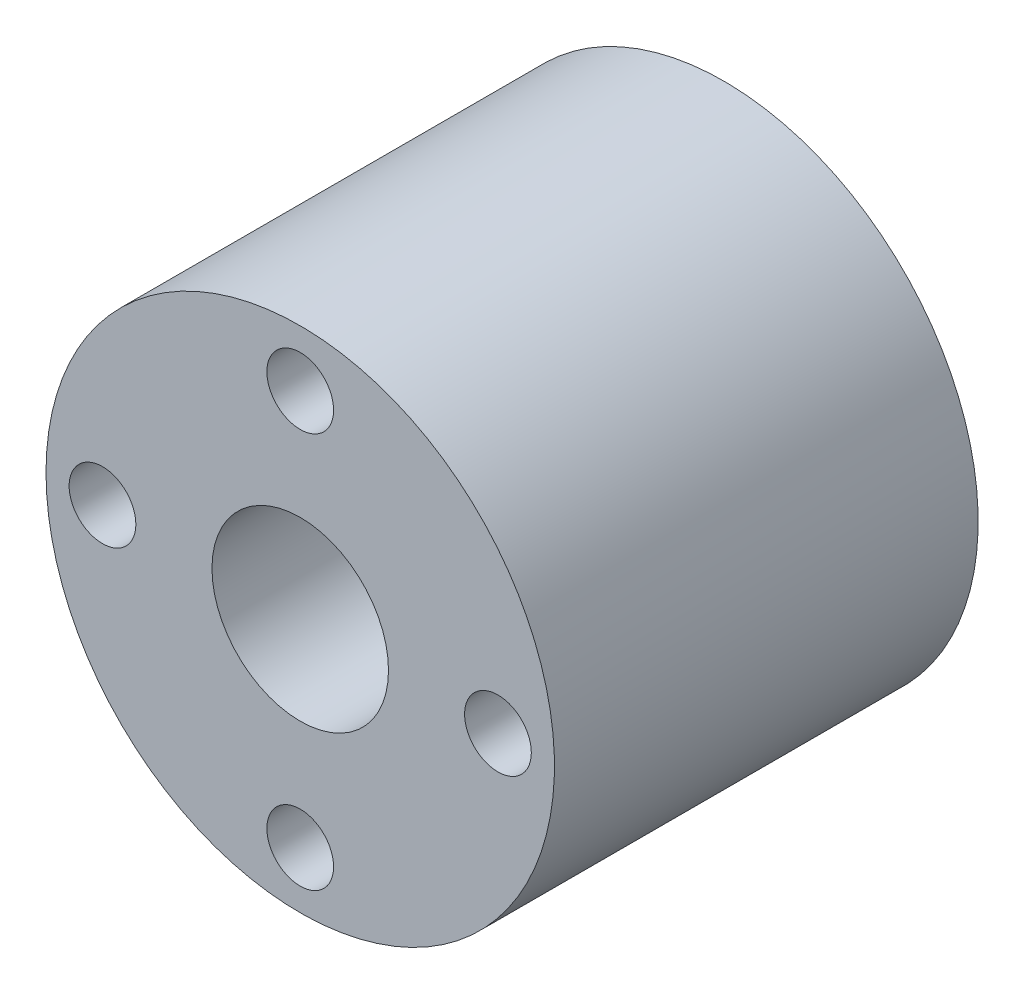
from build123d import *

# Parameters (mm, degrees)
SKETCH1_R             = 11.43
SKETCH1_R_2           = 3.96875
BOSS_EXTRUDE1_DEPTH   = 19.05
F_3_0MM_DOWEL_HOLE1_D = 3
CIRPATTERN1_COUNT     = 4


with BuildPart() as part:
    # Sketch1 → Boss-Extrude1 (new body)
    with BuildSketch(Plane.XY):
        with Locations(Location((0, 0, 0), (0, 0, 180))):
            Circle(SKETCH1_R)
        with Locations(Location((0, 0, 0), (0, 0, 180))):
            Circle(SKETCH1_R_2, mode=Mode.SUBTRACT)
    extrude(amount=BOSS_EXTRUDE1_DEPTH)

    # Ø3.0mm Dowel Hole1 (through all)
    with Locations(Plane.XY.offset(19.05)):
        with Locations((0, 8.89)):
            f_3_0mm_dowel_hole1 = Hole(F_3_0MM_DOWEL_HOLE1_D / 2)

    # CirPattern1: Ø3.0mm Dowel Hole1 ×4 about axis
    cirpattern1_axis = Axis((0, 0, 0), (0, 0, 1))
    for i in range(1, CIRPATTERN1_COUNT):
        add(f_3_0mm_dowel_hole1.rotate(cirpattern1_axis, i * 360 / CIRPATTERN1_COUNT), mode=Mode.SUBTRACT)


solid = part.part
